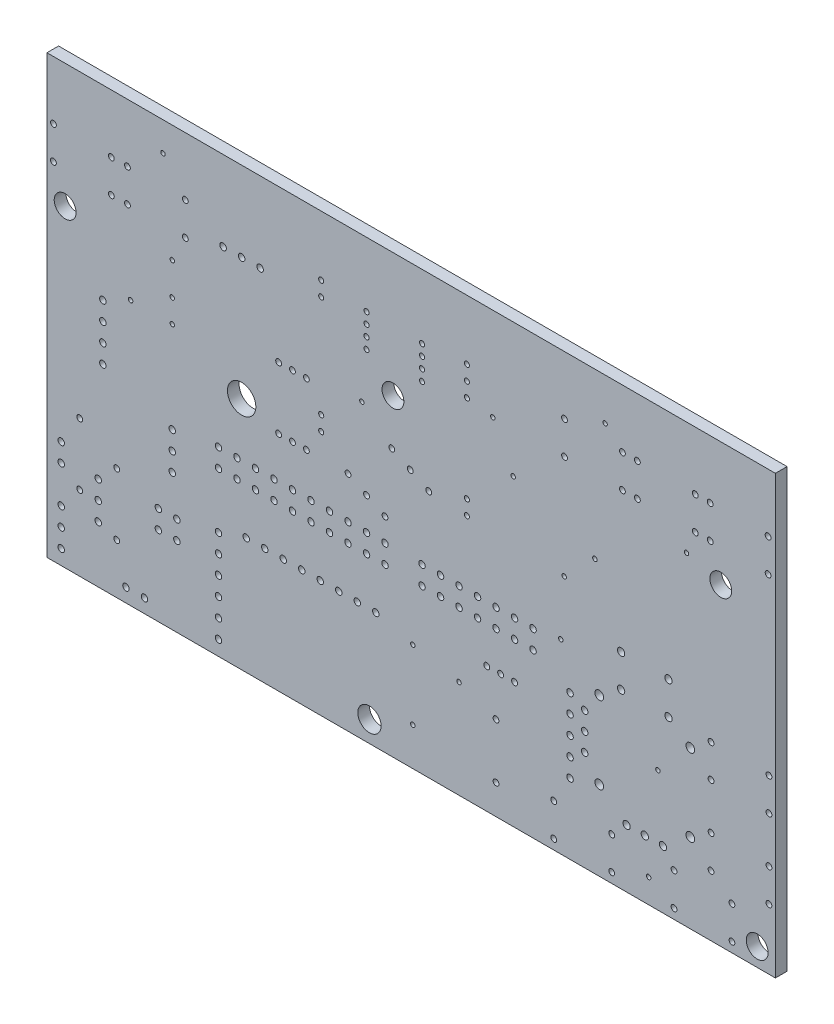
from build123d import *

# Parameters (mm, degrees)
MODEL_W             = 100
MODEL_H             = 60
MODEL_R             = 0.305
MODEL_R_2           = 0.4445
MODEL_R_3           = 0.4
MODEL_R_4           = 1.95
MODEL_R_5           = 0.45
MODEL_R_6           = 1.6
MODEL_R_7           = 0.35
MODEL_R_8           = 0.4065
MODEL_R_9           = 0.5
MODEL_R_10          = 0.6
MODEL_R_11          = 1.5
BOSS_EXTRUDE1_DEPTH = 1.6


with BuildPart() as part:
    # Model → Boss-Extrude1 (new body)
    with BuildSketch(Plane.XY):
        with Locations((490, 475)):
            Rectangle(MODEL_W, MODEL_H)
        with Locations((457.2, 481.33)):
            Circle(MODEL_R, mode=Mode.SUBTRACT)
        with Locations((451.485, 481.33)):
            Circle(MODEL_R, mode=Mode.SUBTRACT)
        with Locations((496.57, 458.47)):
            Circle(MODEL_R, mode=Mode.SUBTRACT)
        with Locations((457.2, 488.95)):
            Circle(MODEL_R, mode=Mode.SUBTRACT)
        with Locations((515.213, 482.437)):
            Circle(MODEL_R, mode=Mode.SUBTRACT)
        with Locations((516.617, 499.252)):
            Circle(MODEL_R, mode=Mode.SUBTRACT)
        with Locations((501.205, 492.256)):
            Circle(MODEL_R, mode=Mode.SUBTRACT)
        with Locations((511.007, 478.255)):
            Circle(MODEL_R, mode=Mode.SUBTRACT)
        with Locations((510.54, 470.535)):
            Circle(MODEL_R, mode=Mode.SUBTRACT)
        with Locations((455.93, 501.015)):
            Circle(MODEL_R, mode=Mode.SUBTRACT)
        with Locations((522.605, 448.31)):
            Circle(MODEL_R, mode=Mode.SUBTRACT)
        with Locations((523.875, 461.645)):
            Circle(MODEL_R, mode=Mode.SUBTRACT)
        with Locations((457.2, 484.505)):
            Circle(MODEL_R, mode=Mode.SUBTRACT)
        with Locations((490.22, 450.215)):
            Circle(MODEL_R, mode=Mode.SUBTRACT)
        with Locations((490.22, 459.74)):
            Circle(MODEL_R, mode=Mode.SUBTRACT)
        with Locations((483.235, 485.14)):
            Circle(MODEL_R, mode=Mode.SUBTRACT)
        with Locations((504, 486.651)):
            Circle(MODEL_R, mode=Mode.SUBTRACT)
        with Locations((527.8, 489.443)):
            Circle(MODEL_R, mode=Mode.SUBTRACT)
        with Locations((494.03, 467.36)):
            Circle(MODEL_R_2, mode=Mode.SUBTRACT)
        with Locations((491.49, 467.36)):
            Circle(MODEL_R_2, mode=Mode.SUBTRACT)
        with Locations((486.41, 467.36)):
            Circle(MODEL_R_2, mode=Mode.SUBTRACT)
        with Locations((483.87, 467.36)):
            Circle(MODEL_R_2, mode=Mode.SUBTRACT)
        with Locations((481.33, 467.36)):
            Circle(MODEL_R_2, mode=Mode.SUBTRACT)
        with Locations((478.79, 467.36)):
            Circle(MODEL_R_2, mode=Mode.SUBTRACT)
        with Locations((476.25, 467.36)):
            Circle(MODEL_R_2, mode=Mode.SUBTRACT)
        with Locations((453.39, 446.886)):
            Circle(MODEL_R_2, mode=Mode.SUBTRACT)
        with Locations((450.85, 446.886)):
            Circle(MODEL_R_2, mode=Mode.SUBTRACT)
        with Locations((457.2, 463.714)):
            Circle(MODEL_R_2, mode=Mode.SUBTRACT)
        with Locations((457.2, 466.254)):
            Circle(MODEL_R_2, mode=Mode.SUBTRACT)
        with Locations((457.2, 468.794)):
            Circle(MODEL_R_2, mode=Mode.SUBTRACT)
        with Locations((447.675, 479.425)):
            Circle(MODEL_R_2, mode=Mode.SUBTRACT)
        with Locations((447.675, 476.885)):
            Circle(MODEL_R_2, mode=Mode.SUBTRACT)
        with Locations((447.675, 474.345)):
            Circle(MODEL_R_2, mode=Mode.SUBTRACT)
        with Locations((447.675, 471.805)):
            Circle(MODEL_R_2, mode=Mode.SUBTRACT)
        with Locations((447.04, 457.835)):
            Circle(MODEL_R_2, mode=Mode.SUBTRACT)
        with Locations((447.04, 455.295)):
            Circle(MODEL_R_2, mode=Mode.SUBTRACT)
        with Locations((447.04, 452.755)):
            Circle(MODEL_R_2, mode=Mode.SUBTRACT)
        with Locations((441.96, 459.74)):
            Circle(MODEL_R_2, mode=Mode.SUBTRACT)
        with Locations((441.96, 457.2)):
            Circle(MODEL_R_2, mode=Mode.SUBTRACT)
        with Locations((449.58, 451.875)):
            Circle(MODEL_R_3, mode=Mode.SUBTRACT)
        with Locations((449.58, 460.375)):
            Circle(MODEL_R_3, mode=Mode.SUBTRACT)
        with Locations((444.5, 463.795)):
            Circle(MODEL_R_3, mode=Mode.SUBTRACT)
        with Locations((444.5, 455.295)):
            Circle(MODEL_R_3, mode=Mode.SUBTRACT)
        with Locations((494.03, 469.9)):
            Circle(MODEL_R_2, mode=Mode.SUBTRACT)
        with Locations((491.49, 469.9)):
            Circle(MODEL_R_2, mode=Mode.SUBTRACT)
        with Locations((496.57, 467.36)):
            Circle(MODEL_R_2, mode=Mode.SUBTRACT)
        with Locations((496.57, 469.9)):
            Circle(MODEL_R_2, mode=Mode.SUBTRACT)
        with Locations((440.89, 497)):
            Circle(MODEL_R_3, mode=Mode.SUBTRACT)
        with Locations((440.89, 492.5)):
            Circle(MODEL_R_3, mode=Mode.SUBTRACT)
        with Locations((448.84, 492.5)):
            Circle(MODEL_R_3, mode=Mode.SUBTRACT)
        with Locations((448.84, 497)):
            Circle(MODEL_R_3, mode=Mode.SUBTRACT)
        with Locations((451.05, 497)):
            Circle(MODEL_R_3, mode=Mode.SUBTRACT)
        with Locations((451.05, 492.5)):
            Circle(MODEL_R_3, mode=Mode.SUBTRACT)
        with Locations((459, 492.5)):
            Circle(MODEL_R_3, mode=Mode.SUBTRACT)
        with Locations((459, 497)):
            Circle(MODEL_R_3, mode=Mode.SUBTRACT)
        with Locations((531.05, 497)):
            Circle(MODEL_R_3, mode=Mode.SUBTRACT)
        with Locations((531.05, 492.5)):
            Circle(MODEL_R_3, mode=Mode.SUBTRACT)
        with Locations((539, 492.5)):
            Circle(MODEL_R_3, mode=Mode.SUBTRACT)
        with Locations((539, 497)):
            Circle(MODEL_R_3, mode=Mode.SUBTRACT)
        with Locations((521.05, 497)):
            Circle(MODEL_R_3, mode=Mode.SUBTRACT)
        with Locations((521.05, 492.5)):
            Circle(MODEL_R_3, mode=Mode.SUBTRACT)
        with Locations((529, 492.5)):
            Circle(MODEL_R_3, mode=Mode.SUBTRACT)
        with Locations((529, 497)):
            Circle(MODEL_R_3, mode=Mode.SUBTRACT)
        with Locations((511.05, 497)):
            Circle(MODEL_R_3, mode=Mode.SUBTRACT)
        with Locations((511.05, 492.5)):
            Circle(MODEL_R_3, mode=Mode.SUBTRACT)
        with Locations((519, 492.5)):
            Circle(MODEL_R_3, mode=Mode.SUBTRACT)
        with Locations((519, 497)):
            Circle(MODEL_R_3, mode=Mode.SUBTRACT)
        with Locations((466.725, 477.23)):
            Circle(MODEL_R_4, mode=Mode.SUBTRACT)
        with Locations((464.185, 494.03)):
            Circle(MODEL_R_5, mode=Mode.SUBTRACT)
        with Locations((466.725, 494.03)):
            Circle(MODEL_R_5, mode=Mode.SUBTRACT)
        with Locations((469.265, 494.03)):
            Circle(MODEL_R_5, mode=Mode.SUBTRACT)
        with Locations((457.835, 455.93)):
            Circle(MODEL_R_2, mode=Mode.SUBTRACT)
        with Locations((455.295, 455.93)):
            Circle(MODEL_R_2, mode=Mode.SUBTRACT)
        with Locations((455.295, 458.47)):
            Circle(MODEL_R_2, mode=Mode.SUBTRACT)
        with Locations((457.835, 458.47)):
            Circle(MODEL_R_2, mode=Mode.SUBTRACT)
        with Locations((441.96, 447.04)):
            Circle(MODEL_R_2, mode=Mode.SUBTRACT)
        with Locations((441.96, 449.58)):
            Circle(MODEL_R_2, mode=Mode.SUBTRACT)
        with Locations((441.96, 452.12)):
            Circle(MODEL_R_2, mode=Mode.SUBTRACT)
        with Locations((484.27, 447.89)):
            Circle(MODEL_R_6, mode=Mode.SUBTRACT)
        with Locations((485.14, 461.01)):
            Circle(MODEL_R_2, mode=Mode.SUBTRACT)
        with Locations((482.6, 461.01)):
            Circle(MODEL_R_2, mode=Mode.SUBTRACT)
        with Locations((480.06, 461.01)):
            Circle(MODEL_R_2, mode=Mode.SUBTRACT)
        with Locations((477.52, 461.01)):
            Circle(MODEL_R_2, mode=Mode.SUBTRACT)
        with Locations((474.98, 461.01)):
            Circle(MODEL_R_2, mode=Mode.SUBTRACT)
        with Locations((472.44, 461.01)):
            Circle(MODEL_R_2, mode=Mode.SUBTRACT)
        with Locations((469.9, 461.01)):
            Circle(MODEL_R_2, mode=Mode.SUBTRACT)
        with Locations((467.36, 461.01)):
            Circle(MODEL_R_2, mode=Mode.SUBTRACT)
        with Locations((471.805, 484.1)):
            Circle(MODEL_R_3, mode=Mode.SUBTRACT)
        with Locations((471.805, 475.6)):
            Circle(MODEL_R_3, mode=Mode.SUBTRACT)
        with Locations((492.42, 479.085)):
            Circle(MODEL_R_3, mode=Mode.SUBTRACT)
        with Locations((486.41, 473.075)):
            Circle(MODEL_R_3, mode=Mode.SUBTRACT)
        with Locations((489.88, 480.355)):
            Circle(MODEL_R_3, mode=Mode.SUBTRACT)
        with Locations((483.87, 474.345)):
            Circle(MODEL_R_3, mode=Mode.SUBTRACT)
        with Locations((473.71, 484.1)):
            Circle(MODEL_R_3, mode=Mode.SUBTRACT)
        with Locations((473.71, 475.6)):
            Circle(MODEL_R_3, mode=Mode.SUBTRACT)
        with Locations((475.615, 484.1)):
            Circle(MODEL_R_3, mode=Mode.SUBTRACT)
        with Locations((475.615, 475.6)):
            Circle(MODEL_R_3, mode=Mode.SUBTRACT)
        with Locations((487.34, 481.625)):
            Circle(MODEL_R_3, mode=Mode.SUBTRACT)
        with Locations((481.33, 475.615)):
            Circle(MODEL_R_3, mode=Mode.SUBTRACT)
        with Locations((491.49, 496.165)):
            Circle(MODEL_R_7, mode=Mode.SUBTRACT)
        with Locations((491.49, 494.665)):
            Circle(MODEL_R_7, mode=Mode.SUBTRACT)
        with Locations((491.49, 493.165)):
            Circle(MODEL_R_7, mode=Mode.SUBTRACT)
        with Locations((491.49, 491.665)):
            Circle(MODEL_R_7, mode=Mode.SUBTRACT)
        with Locations((483.87, 496.165)):
            Circle(MODEL_R_7, mode=Mode.SUBTRACT)
        with Locations((483.87, 494.665)):
            Circle(MODEL_R_7, mode=Mode.SUBTRACT)
        with Locations((483.87, 493.165)):
            Circle(MODEL_R_7, mode=Mode.SUBTRACT)
        with Locations((483.87, 491.665)):
            Circle(MODEL_R_7, mode=Mode.SUBTRACT)
        with Locations((497.65, 494.79)):
            Circle(MODEL_R_7, mode=Mode.SUBTRACT)
        with Locations((497.65, 492.79)):
            Circle(MODEL_R_7, mode=Mode.SUBTRACT)
        with Locations((497.65, 496.79)):
            Circle(MODEL_R_7, mode=Mode.SUBTRACT)
        with Locations((477.65, 494.79)):
            Circle(MODEL_R_7, mode=Mode.SUBTRACT)
        with Locations((477.65, 496.79)):
            Circle(MODEL_R_7, mode=Mode.SUBTRACT)
        with Locations((477.65, 478.79)):
            Circle(MODEL_R_7, mode=Mode.SUBTRACT)
        with Locations((477.65, 480.79)):
            Circle(MODEL_R_7, mode=Mode.SUBTRACT)
        with Locations((497.65, 480.79)):
            Circle(MODEL_R_7, mode=Mode.SUBTRACT)
        with Locations((497.65, 478.79)):
            Circle(MODEL_R_7, mode=Mode.SUBTRACT)
        with Locations((501.65, 449.065)):
            Circle(MODEL_R_3, mode=Mode.SUBTRACT)
        with Locations((501.65, 456.565)):
            Circle(MODEL_R_3, mode=Mode.SUBTRACT)
        with Locations((500.38, 462.28)):
            Circle(MODEL_R_8, mode=Mode.SUBTRACT)
        with Locations((502.285, 462.28)):
            Circle(MODEL_R_8, mode=Mode.SUBTRACT)
        with Locations((504.19, 462.28)):
            Circle(MODEL_R_8, mode=Mode.SUBTRACT)
        with Locations((526.085, 450.85)):
            Circle(MODEL_R_3, mode=Mode.SUBTRACT)
        with Locations((526.085, 446.35)):
            Circle(MODEL_R_3, mode=Mode.SUBTRACT)
        with Locations((534.035, 446.35)):
            Circle(MODEL_R_3, mode=Mode.SUBTRACT)
        with Locations((534.035, 450.85)):
            Circle(MODEL_R_3, mode=Mode.SUBTRACT)
        with Locations((509.575, 450.85)):
            Circle(MODEL_R_3, mode=Mode.SUBTRACT)
        with Locations((509.575, 446.35)):
            Circle(MODEL_R_3, mode=Mode.SUBTRACT)
        with Locations((517.525, 446.35)):
            Circle(MODEL_R_3, mode=Mode.SUBTRACT)
        with Locations((517.525, 450.85)):
            Circle(MODEL_R_3, mode=Mode.SUBTRACT)
        with Locations((531.165, 457.835)):
            Circle(MODEL_R_3, mode=Mode.SUBTRACT)
        with Locations((531.165, 453.335)):
            Circle(MODEL_R_3, mode=Mode.SUBTRACT)
        with Locations((539.115, 453.335)):
            Circle(MODEL_R_3, mode=Mode.SUBTRACT)
        with Locations((539.115, 457.835)):
            Circle(MODEL_R_3, mode=Mode.SUBTRACT)
        with Locations((531.165, 468.63)):
            Circle(MODEL_R_3, mode=Mode.SUBTRACT)
        with Locations((531.165, 464.13)):
            Circle(MODEL_R_3, mode=Mode.SUBTRACT)
        with Locations((539.115, 464.13)):
            Circle(MODEL_R_3, mode=Mode.SUBTRACT)
        with Locations((539.115, 468.63)):
            Circle(MODEL_R_3, mode=Mode.SUBTRACT)
        with Locations((518.82, 473.18)):
            Circle(MODEL_R_9, mode=Mode.SUBTRACT)
        with Locations((525.32, 473.18)):
            Circle(MODEL_R_9, mode=Mode.SUBTRACT)
        with Locations((525.32, 468.68)):
            Circle(MODEL_R_9, mode=Mode.SUBTRACT)
        with Locations((518.82, 468.68)):
            Circle(MODEL_R_9, mode=Mode.SUBTRACT)
        with Locations((513.82, 463.73)):
            Circle(MODEL_R_2, mode=Mode.SUBTRACT)
        with Locations((513.82, 461.23)):
            Circle(MODEL_R_2, mode=Mode.SUBTRACT)
        with Locations((513.82, 458.73)):
            Circle(MODEL_R_2, mode=Mode.SUBTRACT)
        with Locations((528.32, 466.53)):
            Circle(MODEL_R_10, mode=Mode.SUBTRACT)
        with Locations((515.82, 466.53)):
            Circle(MODEL_R_10, mode=Mode.SUBTRACT)
        with Locations((515.82, 455.93)):
            Circle(MODEL_R_10, mode=Mode.SUBTRACT)
        with Locations((528.32, 455.93)):
            Circle(MODEL_R_10, mode=Mode.SUBTRACT)
        with Locations((519.57, 452.98)):
            Circle(MODEL_R_9, mode=Mode.SUBTRACT)
        with Locations((522.07, 452.98)):
            Circle(MODEL_R_9, mode=Mode.SUBTRACT)
        with Locations((524.57, 452.98)):
            Circle(MODEL_R_9, mode=Mode.SUBTRACT)
        with Locations((511.81, 457.2)):
            Circle(MODEL_R_2, mode=Mode.SUBTRACT)
        with Locations((511.81, 459.74)):
            Circle(MODEL_R_2, mode=Mode.SUBTRACT)
        with Locations((511.81, 462.28)):
            Circle(MODEL_R_2, mode=Mode.SUBTRACT)
        with Locations((511.81, 464.82)):
            Circle(MODEL_R_2, mode=Mode.SUBTRACT)
        with Locations((463.55, 447.04)):
            Circle(MODEL_R_2, mode=Mode.SUBTRACT)
        with Locations((463.55, 449.58)):
            Circle(MODEL_R_2, mode=Mode.SUBTRACT)
        with Locations((463.55, 452.12)):
            Circle(MODEL_R_2, mode=Mode.SUBTRACT)
        with Locations((463.55, 454.66)):
            Circle(MODEL_R_2, mode=Mode.SUBTRACT)
        with Locations((463.55, 457.2)):
            Circle(MODEL_R_2, mode=Mode.SUBTRACT)
        with Locations((463.55, 459.74)):
            Circle(MODEL_R_2, mode=Mode.SUBTRACT)
        with Locations((506.73, 467.36)):
            Circle(MODEL_R_2, mode=Mode.SUBTRACT)
        with Locations((504.19, 467.36)):
            Circle(MODEL_R_2, mode=Mode.SUBTRACT)
        with Locations((501.65, 467.36)):
            Circle(MODEL_R_2, mode=Mode.SUBTRACT)
        with Locations((499.11, 467.36)):
            Circle(MODEL_R_2, mode=Mode.SUBTRACT)
        with Locations((506.73, 469.9)):
            Circle(MODEL_R_2, mode=Mode.SUBTRACT)
        with Locations((504.19, 469.9)):
            Circle(MODEL_R_2, mode=Mode.SUBTRACT)
        with Locations((501.65, 469.9)):
            Circle(MODEL_R_2, mode=Mode.SUBTRACT)
        with Locations((499.11, 469.9)):
            Circle(MODEL_R_2, mode=Mode.SUBTRACT)
        with Locations((486.41, 469.9)):
            Circle(MODEL_R_2, mode=Mode.SUBTRACT)
        with Locations((483.87, 469.9)):
            Circle(MODEL_R_2, mode=Mode.SUBTRACT)
        with Locations((481.33, 469.9)):
            Circle(MODEL_R_2, mode=Mode.SUBTRACT)
        with Locations((478.79, 469.9)):
            Circle(MODEL_R_2, mode=Mode.SUBTRACT)
        with Locations((476.25, 469.9)):
            Circle(MODEL_R_2, mode=Mode.SUBTRACT)
        with Locations((473.71, 467.36)):
            Circle(MODEL_R_2, mode=Mode.SUBTRACT)
        with Locations((471.17, 467.36)):
            Circle(MODEL_R_2, mode=Mode.SUBTRACT)
        with Locations((468.63, 467.36)):
            Circle(MODEL_R_2, mode=Mode.SUBTRACT)
        with Locations((466.09, 467.36)):
            Circle(MODEL_R_2, mode=Mode.SUBTRACT)
        with Locations((463.55, 467.36)):
            Circle(MODEL_R_2, mode=Mode.SUBTRACT)
        with Locations((473.71, 469.9)):
            Circle(MODEL_R_2, mode=Mode.SUBTRACT)
        with Locations((471.17, 469.9)):
            Circle(MODEL_R_2, mode=Mode.SUBTRACT)
        with Locations((468.63, 469.9)):
            Circle(MODEL_R_2, mode=Mode.SUBTRACT)
        with Locations((466.09, 469.9)):
            Circle(MODEL_R_2, mode=Mode.SUBTRACT)
        with Locations((463.55, 469.9)):
            Circle(MODEL_R_2, mode=Mode.SUBTRACT)
        with Locations((487.5, 488)):
            Circle(MODEL_R_11, mode=Mode.SUBTRACT)
        with Locations((442.5, 488)):
            Circle(MODEL_R_11, mode=Mode.SUBTRACT)
        with Locations((532.5, 488)):
            Circle(MODEL_R_11, mode=Mode.SUBTRACT)
        with Locations((537.5, 447.5)):
            Circle(MODEL_R_11, mode=Mode.SUBTRACT)
        with Locations((511.81, 454.66)):
            Circle(MODEL_R_2, mode=Mode.SUBTRACT)
    extrude(amount=BOSS_EXTRUDE1_DEPTH)


solid = part.part
